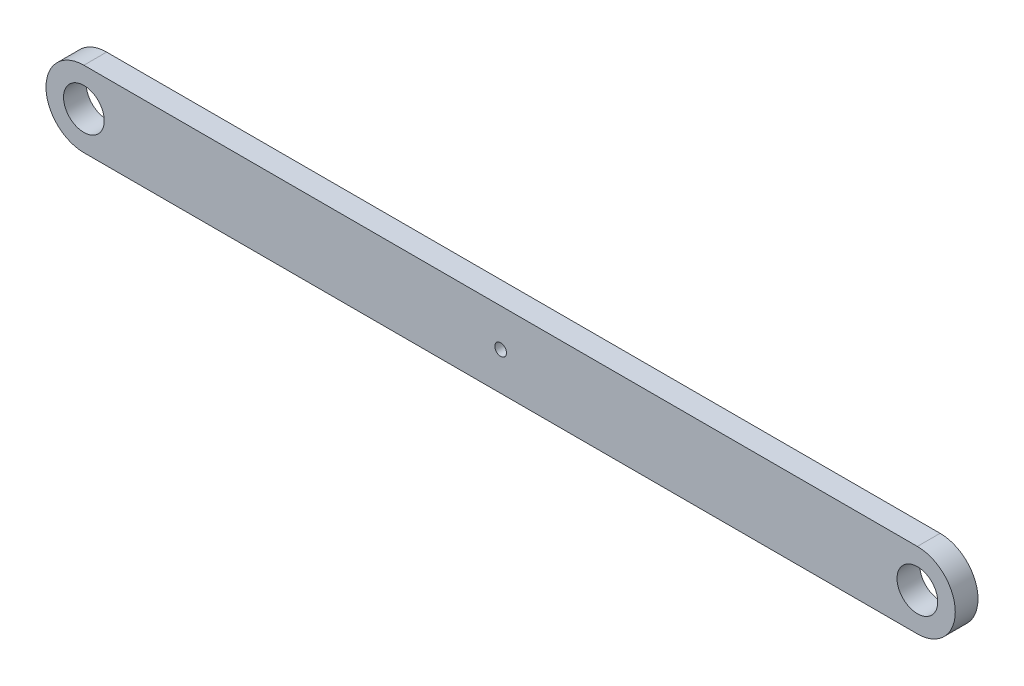
from build123d import *

# Parameters (mm, degrees)
ESQUISSE1_R        = 5.375
ESQUISSE1_R_2      = 1.55
BOSS_EXTRU_1_DEPTH = 6


with BuildPart() as part:
    # Esquisse1 → Boss.-Extru.1 (new body)
    with BuildSketch(Plane.XY):
        with BuildLine():
            Line((0, 0), (220, 0))
            ThreePointArc((220, 0), (230, 10), (220, 20))
            Line((220, 20), (0, 20))
            ThreePointArc((0, 20), (-10, 10), (0, 0))
        make_face()
        with Locations((0, 10)):
            Circle(ESQUISSE1_R, mode=Mode.SUBTRACT)
        with Locations((220, 10)):
            Circle(ESQUISSE1_R, mode=Mode.SUBTRACT)
        with Locations((110, 10)):
            Circle(ESQUISSE1_R_2, mode=Mode.SUBTRACT)
    extrude(amount=BOSS_EXTRU_1_DEPTH)


solid = part.part
